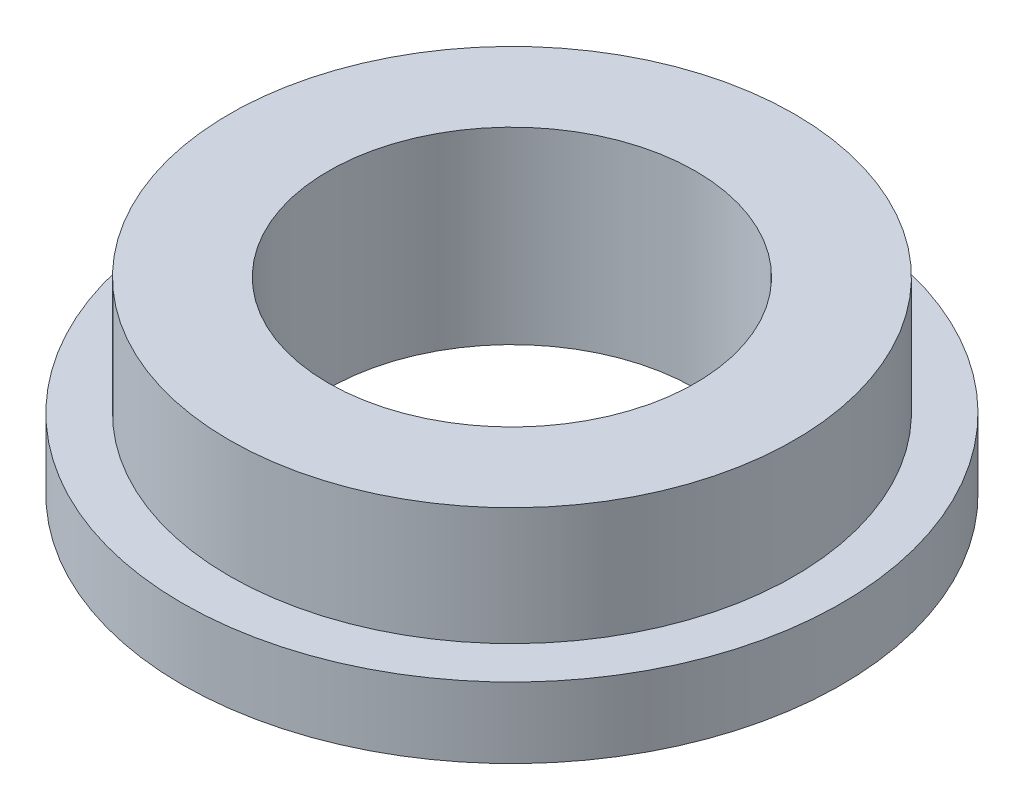
from build123d import *

# Parameters (mm, degrees)
SKETCH_1_R          = 7
EXTRUDE_1_DEPTH     = 1.5
SKETCH_2_R          = 6
EXTRUDE_2_DEPTH     = 2.5
SKETCH_3_R          = 3.9
CUT_EXTRUDE_1_DEPTH = 11.677078252


with BuildPart() as part:
    # 草图1 → 凸台-拉伸1 (new body)
    with BuildSketch(Plane(origin=(0, 0, 0), x_dir=(1, 0, 0), z_dir=(0, 1, 0))):
        with Locations(Location((0, 0, 0), (0, 0, 270))):
            Circle(SKETCH_1_R)
    extrude(amount=EXTRUDE_1_DEPTH)

    # 草图2 → 凸台-拉伸2 (add)
    with BuildSketch(Plane(origin=(0, 1.5, 0), x_dir=(1, 0, 0), z_dir=(0, 1, 0))):
        with Locations(Location((0, 0, 0), (0, 0, 270))):
            Circle(SKETCH_2_R)
    extrude(amount=EXTRUDE_2_DEPTH)

    # 草图3 → 切除-拉伸1 (cut, through all)
    with BuildSketch(Plane(origin=(0, 4, 0), x_dir=(1, 0, 0), z_dir=(0, 1, 0))):
        with Locations(Location((0, 0, 0), (0, 0, 270))):
            Circle(SKETCH_3_R)
    extrude(amount=-CUT_EXTRUDE_1_DEPTH, mode=Mode.SUBTRACT)


with BuildPart() as part_1:
    # Move Body 1: moved
    add(part.part.moved(Location((-171.120476201, -93.573160839, 270.177536174))))


solid = part_1.part
